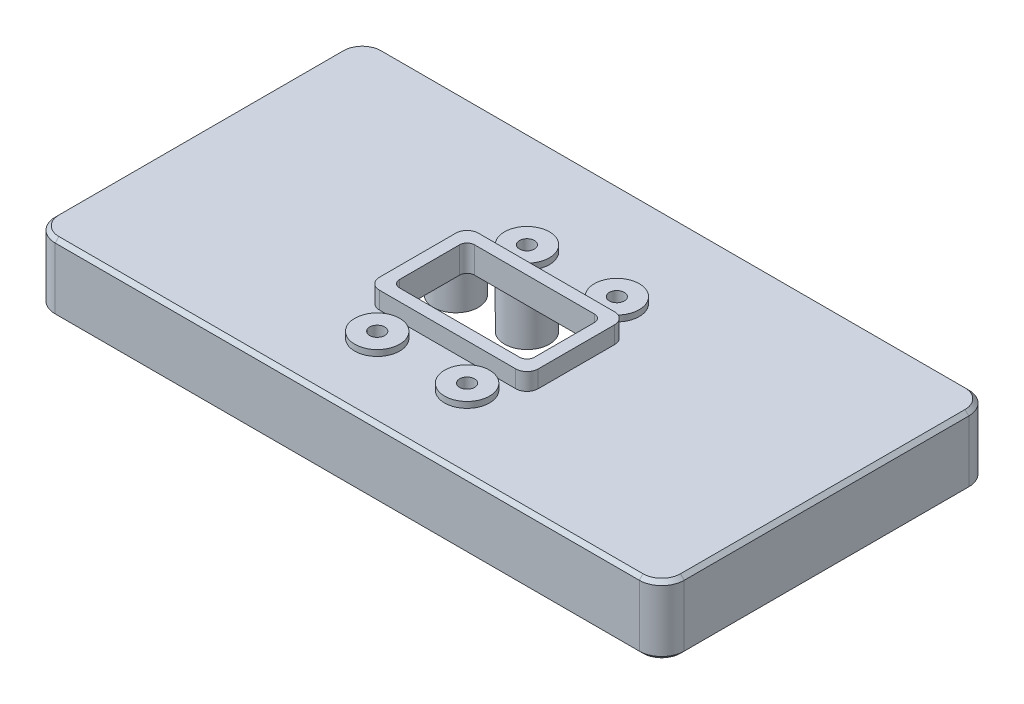
from build123d import *

# Parameters (mm, degrees)
BOSS_EXTRUDE1_START  = 50
BOSS_EXTRUDE1_DEPTH  = 9.2
CHAMFER1_SIZE        = 0.5
CHAMFER2_SIZE        = 0.5
BOSS_EXTRUDE2_START  = 49
BOSS_EXTRUDE2_DEPTH  = 9
BOSS_EXTRUDE3_START  = 50
SKETCH3_R            = 3
BOSS_EXTRUDE3_DEPTH  = 8.01
BOSS_EXTRUDE4_START  = 49
SKETCH4_R            = 1
BOSS_EXTRUDE4_DEPTH  = 9.4
BOSS_EXTRUDE5_START  = 50
SKETCH5_R            = 3
BOSS_EXTRUDE5_DEPTH  = 8.01
BOSS_EXTRUDE6_START  = 49
SKETCH6_R            = 1
BOSS_EXTRUDE6_DEPTH  = 9.4
BOSS_EXTRUDE7_START  = 50
SKETCH7_R            = 3
BOSS_EXTRUDE7_DEPTH  = 8.01
BOSS_EXTRUDE8_START  = 49
SKETCH8_R            = 1
BOSS_EXTRUDE8_DEPTH  = 9.4
BOSS_EXTRUDE9_START  = 50
SKETCH9_R            = 3
BOSS_EXTRUDE9_DEPTH  = 8.01
BOSS_EXTRUDE10_START = 49
SKETCH10_R           = 1
BOSS_EXTRUDE10_DEPTH = 9.4
BOSS_EXTRUDE11_START = 50
SKETCH11_R           = 3
BOSS_EXTRUDE11_DEPTH = 10
BOSS_EXTRUDE12_START = 51.5
SKETCH12_R           = 1
BOSS_EXTRUDE12_DEPTH = 9.5
BOSS_EXTRUDE13_START = 50
SKETCH13_R           = 3
BOSS_EXTRUDE13_DEPTH = 10
BOSS_EXTRUDE14_START = 51.5
SKETCH14_R           = 1
BOSS_EXTRUDE14_DEPTH = 9.5
BOSS_EXTRUDE15_START = 50
SKETCH15_R           = 3
BOSS_EXTRUDE15_DEPTH = 10
BOSS_EXTRUDE16_START = 51.5
SKETCH16_R           = 1
BOSS_EXTRUDE16_DEPTH = 9.5
BOSS_EXTRUDE17_START = 50
SKETCH17_R           = 3
BOSS_EXTRUDE17_DEPTH = 10
BOSS_EXTRUDE18_START = 51.5
SKETCH18_R           = 1
BOSS_EXTRUDE18_DEPTH = 9.5
BOSS_EXTRUDE19_START = 50
BOSS_EXTRUDE19_DEPTH = 1.2
BOSS_EXTRUDE20_START = 57.99
BOSS_EXTRUDE20_DEPTH = 3.51
BOSS_EXTRUDE21_START = 49
BOSS_EXTRUDE21_DEPTH = 13


with BuildPart() as part:
    # Sketch1 → Boss-Extrude1 (new body)
    with BuildSketch(Plane(origin=(0, 0, 0), x_dir=(1, 0, 0), z_dir=(0, 1, 0)).offset(BOSS_EXTRUDE1_START)):
        with BuildLine():
            Line((-39, -36), (39, -36))
            ThreePointArc((39, -36), (41.121320344, -36.878679656), (42, -39))
            Line((42, -39), (42, -77))
            ThreePointArc((42, -77), (41.121320344, -79.121320344), (39, -80))
            Line((39, -80), (-39, -80))
            ThreePointArc((-39, -80), (-41.121320344, -79.121320344), (-42, -77))
            Line((-42, -77), (-42, -39))
            ThreePointArc((-42, -39), (-41.121320344, -36.878679656), (-39, -36))
        make_face()
    extrude(amount=BOSS_EXTRUDE1_DEPTH)

    # Chamfer1
    chamfer1_edges = [part.edges().sort_by_distance(p)[0] for p in [
        (0, 50, 36),
        (-41.121320344, 50, 36.878679656),
        (41.121320344, 50, 36.878679656),
        (-42, 50, 58),
        (42, 50, 58),
        (-41.121320344, 50, 79.121320344),
        (41.121320344, 50, 79.121320344),
        (0, 50, 80),
    ]]
    chamfer(chamfer1_edges, length=CHAMFER1_SIZE)

    # Chamfer2
    chamfer2_edges = [part.edges().sort_by_distance(p)[0] for p in [
        (0, 59.2, 36),
        (-41.121320344, 59.2, 36.878679656),
        (41.121320344, 59.2, 36.878679656),
        (-42, 59.2, 58),
        (42, 59.2, 58),
        (-41.121320344, 59.2, 79.121320344),
        (41.121320344, 59.2, 79.121320344),
        (0, 59.2, 80),
    ]]
    chamfer(chamfer2_edges, length=CHAMFER2_SIZE)


with BuildPart() as body_2:
    # Sketch2 → Boss-Extrude2 (new body)
    with BuildSketch(Plane(origin=(0, 0, 0), x_dir=(1, 0, 0), z_dir=(0, 1, 0)).offset(BOSS_EXTRUDE2_START)):
        with BuildLine():
            Line((-39, -37.6), (39, -37.6))
            ThreePointArc((39, -37.6), (39.989949494, -38.010050506), (40.4, -39))
            Line((40.4, -39), (40.4, -77))
            ThreePointArc((40.4, -77), (39.989949494, -77.989949494), (39, -78.4))
            Line((39, -78.4), (-39, -78.4))
            ThreePointArc((-39, -78.4), (-39.989949494, -77.989949494), (-40.4, -77))
            Line((-40.4, -77), (-40.4, -39))
            ThreePointArc((-40.4, -39), (-39.989949494, -38.010050506), (-39, -37.6))
        make_face()
    extrude(amount=BOSS_EXTRUDE2_DEPTH)


with BuildPart() as part_1:
    add(part.part)

    # Combine1: cut body 2
    add(body_2.part, mode=Mode.SUBTRACT)

    # Sketch3 → Boss-Extrude3 (add)
    with BuildSketch(Plane(origin=(0, 0, 0), x_dir=(1, 0, 0), z_dir=(0, 1, 0)).offset(BOSS_EXTRUDE3_START)):
        with Locations((-15, -50.5)):
            Circle(SKETCH3_R)
    extrude(amount=BOSS_EXTRUDE3_DEPTH)


with BuildPart() as body_2_2:
    # Sketch4 → Boss-Extrude4 (new body)
    with BuildSketch(Plane(origin=(0, 0, 0), x_dir=(1, 0, 0), z_dir=(0, 1, 0)).offset(BOSS_EXTRUDE4_START)):
        with Locations((-15, -50.5)):
            Circle(SKETCH4_R)
    extrude(amount=BOSS_EXTRUDE4_DEPTH)


with BuildPart() as part_2:
    add(part_1.part)

    # Combine2: cut body 2 2
    add(body_2_2.part, mode=Mode.SUBTRACT)

    # Sketch5 → Boss-Extrude5 (add)
    with BuildSketch(Plane(origin=(0, 0, 0), x_dir=(1, 0, 0), z_dir=(0, 1, 0)).offset(BOSS_EXTRUDE5_START)):
        with Locations((-15, -69.5)):
            Circle(SKETCH5_R)
    extrude(amount=BOSS_EXTRUDE5_DEPTH)


with BuildPart() as body_2_3:
    # Sketch6 → Boss-Extrude6 (new body)
    with BuildSketch(Plane(origin=(0, 0, 0), x_dir=(1, 0, 0), z_dir=(0, 1, 0)).offset(BOSS_EXTRUDE6_START)):
        with Locations((-15, -69.5)):
            Circle(SKETCH6_R)
    extrude(amount=BOSS_EXTRUDE6_DEPTH)


with BuildPart() as part_3:
    add(part_2.part)

    # Combine3: cut body 2 3
    add(body_2_3.part, mode=Mode.SUBTRACT)

    # Sketch7 → Boss-Extrude7 (add)
    with BuildSketch(Plane(origin=(0, 0, 0), x_dir=(1, 0, 0), z_dir=(0, 1, 0)).offset(BOSS_EXTRUDE7_START)):
        with Locations((15, -50.5)):
            Circle(SKETCH7_R)
    extrude(amount=BOSS_EXTRUDE7_DEPTH)


with BuildPart() as body_2_4:
    # Sketch8 → Boss-Extrude8 (new body)
    with BuildSketch(Plane(origin=(0, 0, 0), x_dir=(1, 0, 0), z_dir=(0, 1, 0)).offset(BOSS_EXTRUDE8_START)):
        with Locations((15, -50.5)):
            Circle(SKETCH8_R)
    extrude(amount=BOSS_EXTRUDE8_DEPTH)


with BuildPart() as part_4:
    add(part_3.part)

    # Combine4: cut body 2 4
    add(body_2_4.part, mode=Mode.SUBTRACT)

    # Sketch9 → Boss-Extrude9 (add)
    with BuildSketch(Plane(origin=(0, 0, 0), x_dir=(1, 0, 0), z_dir=(0, 1, 0)).offset(BOSS_EXTRUDE9_START)):
        with Locations((15, -69.5)):
            Circle(SKETCH9_R)
    extrude(amount=BOSS_EXTRUDE9_DEPTH)


with BuildPart() as body_2_5:
    # Sketch10 → Boss-Extrude10 (new body)
    with BuildSketch(Plane(origin=(0, 0, 0), x_dir=(1, 0, 0), z_dir=(0, 1, 0)).offset(BOSS_EXTRUDE10_START)):
        with Locations((15, -69.5)):
            Circle(SKETCH10_R)
    extrude(amount=BOSS_EXTRUDE10_DEPTH)


with BuildPart() as part_5:
    add(part_4.part)

    # Combine5: cut body 2 5
    add(body_2_5.part, mode=Mode.SUBTRACT)

    # Sketch11 → Boss-Extrude11 (add)
    with BuildSketch(Plane(origin=(0, 0, 0), x_dir=(1, 0, 0), z_dir=(0, 1, 0)).offset(BOSS_EXTRUDE11_START)):
        with Locations((-6, -50)):
            Circle(SKETCH11_R)
    extrude(amount=BOSS_EXTRUDE11_DEPTH)


with BuildPart() as body_2_6:
    # Sketch12 → Boss-Extrude12 (new body)
    with BuildSketch(Plane(origin=(0, 0, 0), x_dir=(1, 0, 0), z_dir=(0, 1, 0)).offset(BOSS_EXTRUDE12_START)):
        with Locations((-6, -50)):
            Circle(SKETCH12_R)
    extrude(amount=BOSS_EXTRUDE12_DEPTH)


with BuildPart() as part_6:
    add(part_5.part)

    # Combine6: cut body 2 6
    add(body_2_6.part, mode=Mode.SUBTRACT)

    # Sketch13 → Boss-Extrude13 (add)
    with BuildSketch(Plane(origin=(0, 0, 0), x_dir=(1, 0, 0), z_dir=(0, 1, 0)).offset(BOSS_EXTRUDE13_START)):
        with Locations((-6, -70)):
            Circle(SKETCH13_R)
    extrude(amount=BOSS_EXTRUDE13_DEPTH)


with BuildPart() as body_2_7:
    # Sketch14 → Boss-Extrude14 (new body)
    with BuildSketch(Plane(origin=(0, 0, 0), x_dir=(1, 0, 0), z_dir=(0, 1, 0)).offset(BOSS_EXTRUDE14_START)):
        with Locations((-6, -70)):
            Circle(SKETCH14_R)
    extrude(amount=BOSS_EXTRUDE14_DEPTH)


with BuildPart() as part_7:
    add(part_6.part)

    # Combine7: cut body 2 7
    add(body_2_7.part, mode=Mode.SUBTRACT)

    # Sketch15 → Boss-Extrude15 (add)
    with BuildSketch(Plane(origin=(0, 0, 0), x_dir=(1, 0, 0), z_dir=(0, 1, 0)).offset(BOSS_EXTRUDE15_START)):
        with Locations((6, -50)):
            Circle(SKETCH15_R)
    extrude(amount=BOSS_EXTRUDE15_DEPTH)


with BuildPart() as body_2_8:
    # Sketch16 → Boss-Extrude16 (new body)
    with BuildSketch(Plane(origin=(0, 0, 0), x_dir=(1, 0, 0), z_dir=(0, 1, 0)).offset(BOSS_EXTRUDE16_START)):
        with Locations((6, -50)):
            Circle(SKETCH16_R)
    extrude(amount=BOSS_EXTRUDE16_DEPTH)


with BuildPart() as part_8:
    add(part_7.part)

    # Combine8: cut body 2 8
    add(body_2_8.part, mode=Mode.SUBTRACT)

    # Sketch17 → Boss-Extrude17 (add)
    with BuildSketch(Plane(origin=(0, 0, 0), x_dir=(1, 0, 0), z_dir=(0, 1, 0)).offset(BOSS_EXTRUDE17_START)):
        with Locations((6, -70)):
            Circle(SKETCH17_R)
    extrude(amount=BOSS_EXTRUDE17_DEPTH)


with BuildPart() as body_2_9:
    # Sketch18 → Boss-Extrude18 (new body)
    with BuildSketch(Plane(origin=(0, 0, 0), x_dir=(1, 0, 0), z_dir=(0, 1, 0)).offset(BOSS_EXTRUDE18_START)):
        with Locations((6, -70)):
            Circle(SKETCH18_R)
    extrude(amount=BOSS_EXTRUDE18_DEPTH)


with BuildPart() as part_9:
    add(part_8.part)

    # Combine9: cut body 2 9
    add(body_2_9.part, mode=Mode.SUBTRACT)

    # Sketch19 → Boss-Extrude19 (add)
    with BuildSketch(Plane(origin=(0, 0, 0), x_dir=(1, 0, 0), z_dir=(0, 1, 0)).offset(BOSS_EXTRUDE19_START)):
        with BuildLine():
            Line((-38.99, -37.59), (38.99, -37.59))
            ThreePointArc((38.99, -37.59), (39.979949494, -38.000050506), (40.39, -38.99))
            Line((40.39, -38.99), (40.39, -77.01))
            ThreePointArc((40.39, -77.01), (39.979949494, -77.999949494), (38.99, -78.41))
            Line((38.99, -78.41), (-38.99, -78.41))
            ThreePointArc((-38.99, -78.41), (-39.979949494, -77.999949494), (-40.39, -77.01))
            Line((-40.39, -77.01), (-40.39, -38.99))
            ThreePointArc((-40.39, -38.99), (-39.979949494, -38.000050506), (-38.99, -37.59))
        make_face()
        with BuildLine():
            Line((-33.6, -39.6), (33.6, -39.6))
            ThreePointArc((33.6, -39.6), (34.307106781, -39.892893219), (34.6, -40.6))
            Line((34.6, -40.6), (34.6, -71.6))
            ThreePointArc((34.6, -71.6), (34.307106781, -72.307106781), (33.6, -72.6))
            Line((33.6, -72.6), (-33.6, -72.6))
            ThreePointArc((-33.6, -72.6), (-34.307106781, -72.307106781), (-34.6, -71.6))
            Line((-34.6, -71.6), (-34.6, -40.6))
            ThreePointArc((-34.6, -40.6), (-34.307106781, -39.892893219), (-33.6, -39.6))
        make_face(mode=Mode.SUBTRACT)
    extrude(amount=BOSS_EXTRUDE19_DEPTH)

    # Sketch20 → Boss-Extrude20 (add)
    with BuildSketch(Plane(origin=(0, 0, 0), x_dir=(1, 0, 0), z_dir=(0, 1, 0)).offset(BOSS_EXTRUDE20_START)):
        with BuildLine():
            Line((-9.1, -53.4), (9.1, -53.4))
            ThreePointArc((9.1, -53.4), (10.160660172, -53.839339828), (10.6, -54.9))
            Line((10.6, -54.9), (10.6, -65.1))
            ThreePointArc((10.6, -65.1), (10.160660172, -66.160660172), (9.1, -66.6))
            Line((9.1, -66.6), (-9.1, -66.6))
            ThreePointArc((-9.1, -66.6), (-10.160660172, -66.160660172), (-10.6, -65.1))
            Line((-10.6, -65.1), (-10.6, -54.9))
            ThreePointArc((-10.6, -54.9), (-10.160660172, -53.839339828), (-9.1, -53.4))
        make_face()
    extrude(amount=BOSS_EXTRUDE20_DEPTH)


with BuildPart() as body_2_10:
    # Sketch21 → Boss-Extrude21 (new body)
    with BuildSketch(Plane(origin=(0, 0, 0), x_dir=(1, 0, 0), z_dir=(0, 1, 0)).offset(BOSS_EXTRUDE21_START)):
        with BuildLine():
            Line((-8, -55), (8, -55))
            ThreePointArc((8, -55), (8.707106781, -55.292893219), (9, -56))
            Line((9, -56), (9, -64))
            ThreePointArc((9, -64), (8.707106781, -64.707106781), (8, -65))
            Line((8, -65), (-8, -65))
            ThreePointArc((-8, -65), (-8.707106781, -64.707106781), (-9, -64))
            Line((-9, -64), (-9, -56))
            ThreePointArc((-9, -56), (-8.707106781, -55.292893219), (-8, -55))
        make_face()
    extrude(amount=BOSS_EXTRUDE21_DEPTH)


with BuildPart() as part_10:
    add(part_9.part)

    # Combine10: cut body 2 10
    add(body_2_10.part, mode=Mode.SUBTRACT)


solid = part_10.part
